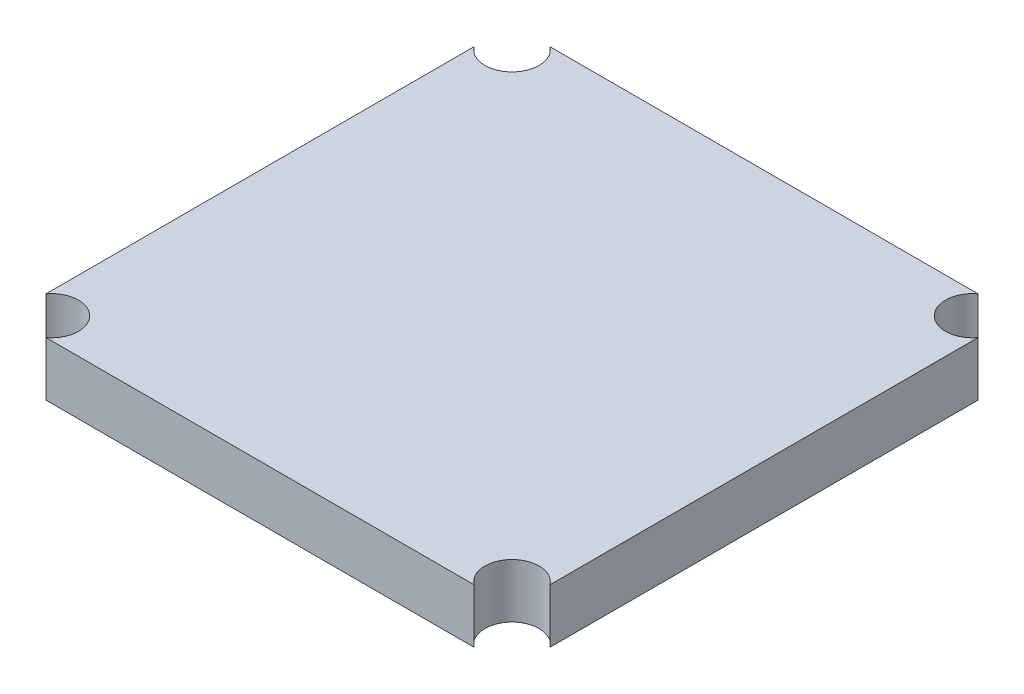
from build123d import *

# Parameters (mm, degrees)
FLIGHT_COMPUTER_DEPTH = 3


with BuildPart() as part:
    # Sketch2 → Flight Computer (new body)
    with BuildSketch(Plane(origin=(0, 0, 0), x_dir=(1, 0, 0), z_dir=(0, 1, 0))):
        with BuildLine():
            ThreePointArc((-11.25, 12.75), (-12.275658351, 11.326975053), (-13.95, 11.85))
            Line((-13.95, 11.85), (-13.95, -11.85))
            ThreePointArc((-13.95, -11.85), (-12.275658351, -11.326975053), (-11.25, -12.75))
            ThreePointArc((-11.25, -12.75), (-11.408359213, -13.420820393), (-11.85, -13.95))
            Line((-11.85, -13.95), (11.85, -13.95))
            ThreePointArc((11.85, -13.95), (11.689339828, -11.689339828), (13.95, -11.85))
            Line((13.95, -11.85), (13.95, 11.85))
            ThreePointArc((13.95, 11.85), (11.689339828, 11.689339828), (11.85, 13.95))
            Line((11.85, 13.95), (-11.85, 13.95))
            ThreePointArc((-11.85, 13.95), (-11.408359214, 13.420820393), (-11.25, 12.75))
        make_face()
    extrude(amount=FLIGHT_COMPUTER_DEPTH)


solid = part.part
